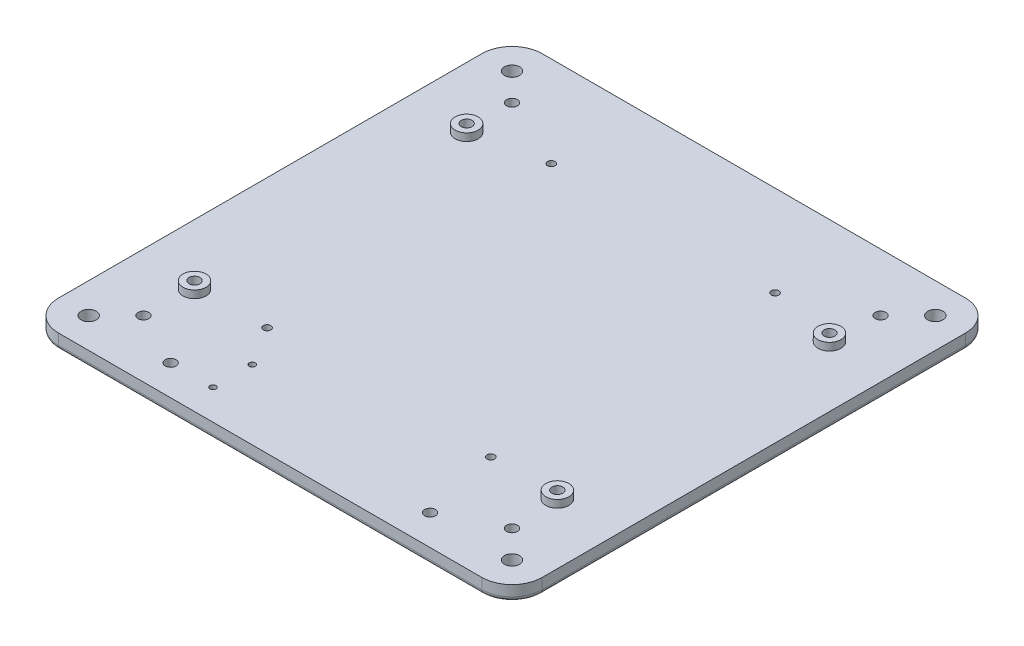
from build123d import *

# Parameters (mm, degrees)
SKETCH1_W           = 203.2
SKETCH1_H           = 203.2
BOSS_EXTRUDE1_DEPTH = 6.35
FILLET1_R           = 12.7
SKETCH2_R           = 3.175
CUT_EXTRUDE1_DEPTH  = 288.438345563
FILLET2_R           = 1.905
SKETCH3_R           = 2.286
CUT_EXTRUDE2_DEPTH  = 288.438345634
SKETCH4_R           = 2.286
CUT_EXTRUDE3_DEPTH  = 288.438345634
SKETCH5_R           = 4.826
SKETCH5_R_2         = 2.286
BOSS_EXTRUDE2_DEPTH = 3.175
SKETCH6_R           = 1.27
CUT_EXTRUDE4_DEPTH  = 288.438345634
SKETCH7_R           = 1.5875
CUT_EXTRUDE5_DEPTH  = 288.438345634


with BuildPart() as part:
    # Sketch1 → Boss-Extrude1 (new body)
    with BuildSketch(Plane(origin=(0, 0, 0), x_dir=(1, 0, 0), z_dir=(0, 1, 0))):
        with Locations((101.6, 101.6)):
            Rectangle(SKETCH1_W, SKETCH1_H)
    extrude(amount=BOSS_EXTRUDE1_DEPTH)

    # Fillet1
    fillet1_edges = [part.edges().sort_by_distance(p)[0] for p in [
        (0, 3.175, -203.2),
        (203.2, 3.175, -203.2),
        (203.2, 3.175, 0),
        (0, 3.175, 0),
    ]]
    fillet(fillet1_edges, radius=FILLET1_R)

    # Sketch2 → Cut-Extrude1 (cut, through all)
    with BuildSketch(Plane.XZ):
        with Locations(Location((12.7, -12.7, 0), (0, 0, 270))):
            Circle(SKETCH2_R)
        with Locations(Location((190.5, -12.7, 0), (0, 0, 270))):
            Circle(SKETCH2_R)
        with Locations(Location((190.5, -190.5, 0), (0, 0, 270))):
            Circle(SKETCH2_R)
        with Locations(Location((12.7, -190.5, 0), (0, 0, 270))):
            Circle(SKETCH2_R)
    extrude(amount=-CUT_EXTRUDE1_DEPTH, mode=Mode.SUBTRACT)

    # Fillet2
    fillet2_edges = [part.edges().sort_by_distance(p)[0] for p in [
        (0, 0, -101.6),
        (101.6, 0, -203.2),
        (203.2, 0, -101.6),
        (101.6, 0, 0),
        (199.480256121, 0, -199.480256121),
        (199.480256121, 0, -3.719743879),
        (3.719743879, 0, -3.719743879),
        (3.719743879, 0, -199.480256121),
        (12.7, 0, -187.325),
        (190.5, 0, -187.325),
        (190.5, 0, -9.525),
        (12.7, 0, -9.525),
    ]]
    fillet(fillet2_edges, radius=FILLET2_R)

    # Sketch3 → Cut-Extrude2 (cut, through all)
    with BuildSketch(Plane(origin=(0, 6.35, 0), x_dir=(1, 0, 0), z_dir=(0, 1, 0))):
        with Locations(Location((24.197781122, 24.197781122, 0), (0, 0, 270))):
            Circle(SKETCH3_R)
        with Locations(Location((179.002218878, 179.002218878, 0), (0, 0, 270))):
            Circle(SKETCH3_R)
        with Locations(Location((179.002218878, 24.197781122, 0), (0, 0, 270))):
            Circle(SKETCH3_R)
        with Locations(Location((24.197781122, 179.002218878, 0), (0, 0, 270))):
            Circle(SKETCH3_R)
    extrude(amount=-CUT_EXTRUDE2_DEPTH, mode=Mode.SUBTRACT)

    # Sketch4 → Cut-Extrude3 (cut, through all)
    with BuildSketch(Plane(origin=(0, 6.35, 0), x_dir=(1, 0, 0), z_dir=(0, 1, 0))):
        with Locations(Location((47.117, 12.7, 0), (0, 0, 270))):
            Circle(SKETCH4_R)
        with Locations(Location((156.083, 12.7, 0), (0, 0, 270))):
            Circle(SKETCH4_R)
    extrude(amount=-CUT_EXTRUDE3_DEPTH, mode=Mode.SUBTRACT)

    # Sketch5 → Boss-Extrude2 (add)
    # profile 1 of 4: a face of its own
    with BuildSketch(Plane(origin=(0, 6.35, 0), x_dir=(1, 0, 0), z_dir=(0, 1, 0))):
        with Locations(Location((25.4, 158.75, 0), (0, 0, 90))):
            Circle(SKETCH5_R)
        with Locations(Location((25.4, 158.75, 0), (0, 0, 270))):
            Circle(SKETCH5_R_2, mode=Mode.SUBTRACT)
    # profile 2 of 4: a face of its own
    with BuildSketch(Plane(origin=(0, 6.35, 0), x_dir=(1, 0, 0), z_dir=(0, 1, 0))):
        with Locations(Location((177.8, 158.75, 0), (0, 0, 90))):
            Circle(SKETCH5_R)
        with Locations(Location((177.8, 158.75, 0), (0, 0, 270))):
            Circle(SKETCH5_R_2, mode=Mode.SUBTRACT)
    # profile 3 of 4: a face of its own
    with BuildSketch(Plane(origin=(0, 6.35, 0), x_dir=(1, 0, 0), z_dir=(0, 1, 0))):
        with Locations(Location((177.8, 44.45, 0), (0, 0, 90))):
            Circle(SKETCH5_R)
        with Locations(Location((177.8, 44.45, 0), (0, 0, 270))):
            Circle(SKETCH5_R_2, mode=Mode.SUBTRACT)
    # profile 4 of 4: a face of its own
    with BuildSketch(Plane(origin=(0, 6.35, 0), x_dir=(1, 0, 0), z_dir=(0, 1, 0))):
        with Locations(Location((25.4, 44.45, 0), (0, 0, 90))):
            Circle(SKETCH5_R)
        with Locations(Location((25.4, 44.45, 0), (0, 0, 270))):
            Circle(SKETCH5_R_2, mode=Mode.SUBTRACT)
    extrude(amount=BOSS_EXTRUDE2_DEPTH)

    # Sketch6 → Cut-Extrude4 (cut, through all)
    with BuildSketch(Plane(origin=(0, 6.35, 0), x_dir=(1, 0, 0), z_dir=(0, 1, 0))):
        with Locations(Location((64.897, 29.21, 0), (0, 0, 270))):
            Circle(SKETCH6_R)
        with Locations(Location((64.897, 12.7, 0), (0, 0, 270))):
            Circle(SKETCH6_R)
    extrude(amount=-CUT_EXTRUDE4_DEPTH, mode=Mode.SUBTRACT)

    # Sketch7 → Cut-Extrude5 (cut, through all)
    with BuildSketch(Plane(origin=(0, 6.35, 0), x_dir=(1, 0, 0), z_dir=(0, 1, 0))):
        with Locations(Location((54.61, 45.72, 0), (0, 0, 270))):
            Circle(SKETCH7_R)
        with Locations(Location((54.61, 165.1, 0), (0, 0, 270))):
            Circle(SKETCH7_R)
        with Locations(Location((148.59, 165.1, 0), (0, 0, 270))):
            Circle(SKETCH7_R)
        with Locations(Location((148.59, 45.72, 0), (0, 0, 270))):
            Circle(SKETCH7_R)
    extrude(amount=-CUT_EXTRUDE5_DEPTH, mode=Mode.SUBTRACT)


solid = part.part
